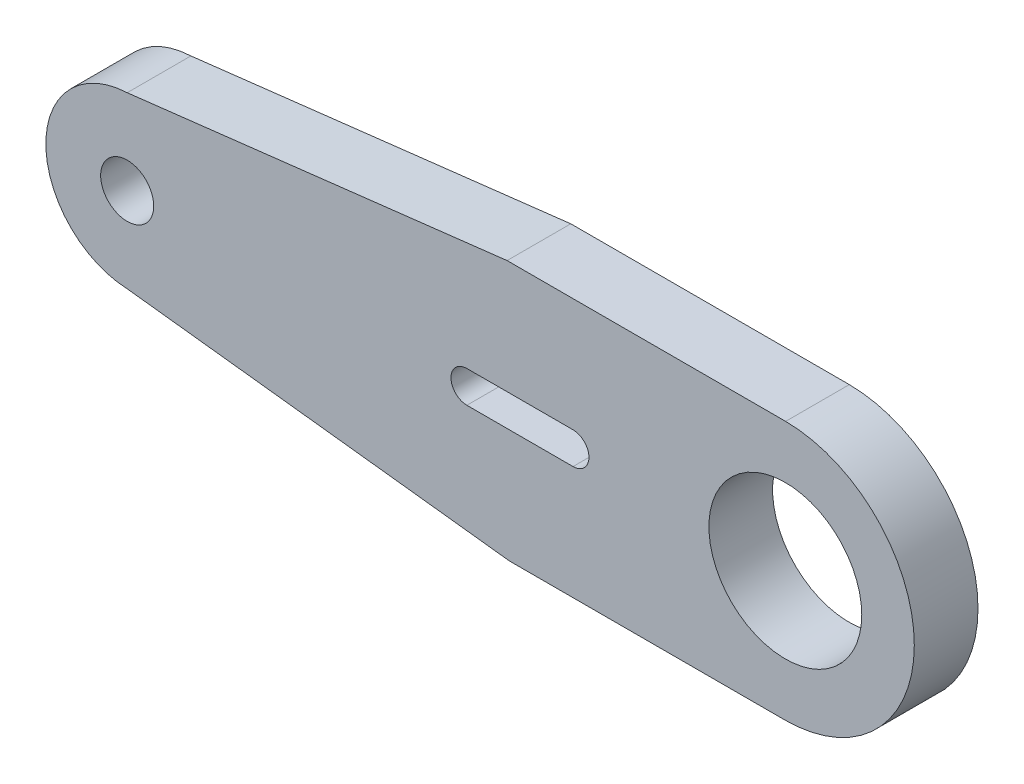
from build123d import *

# Parameters (mm, degrees)
SKETCH_1_R      = 1.25
SKETCH_1_R_2    = 3.6
EXTRUDE_1_DEPTH = 3


with BuildPart() as part:
    # 草圖1 → 填料-伸長1 (new body)
    with BuildSketch(Plane.XY):
        with BuildLine():
            Line((266.940039041, 70.187616223), (253.819051616, 70.186947452))
            Line((253.819051616, 70.186947452), (235.924992032, 68.086947452))
            ThreePointArc((235.924992032, 68.086947452), (232.093013182, 64.086947452), (235.924992032, 60.086947452))
            Line((235.924992032, 60.086947452), (253.924893648, 57.986947452))
            Line((253.924893648, 57.986947452), (266.924893648, 57.986947452))
            ThreePointArc((266.924893648, 57.986947452), (273.0002, 64.07974961), (266.940039041, 70.187616223))
        make_face()
        with Locations((235.924992032, 64.086947452)):
            Circle(SKETCH_1_R, mode=Mode.SUBTRACT)
        with Locations((266.924883927, 64.086997452)):
            Circle(SKETCH_1_R_2, mode=Mode.SUBTRACT)
        with BuildLine():
            Line((256.924908926, 63.336947456), (251.924915279, 63.336947455))
            ThreePointArc((251.924915279, 63.336947455), (251.174915281, 64.086947452), (251.924915279, 64.83694745))
            Line((251.924915279, 64.83694745), (256.924908926, 64.83694745))
            ThreePointArc((256.924908926, 64.83694745), (257.674908923, 64.086947453), (256.924908926, 63.336947456))
        make_face(mode=Mode.SUBTRACT)
    extrude(amount=EXTRUDE_1_DEPTH)


solid = part.part
